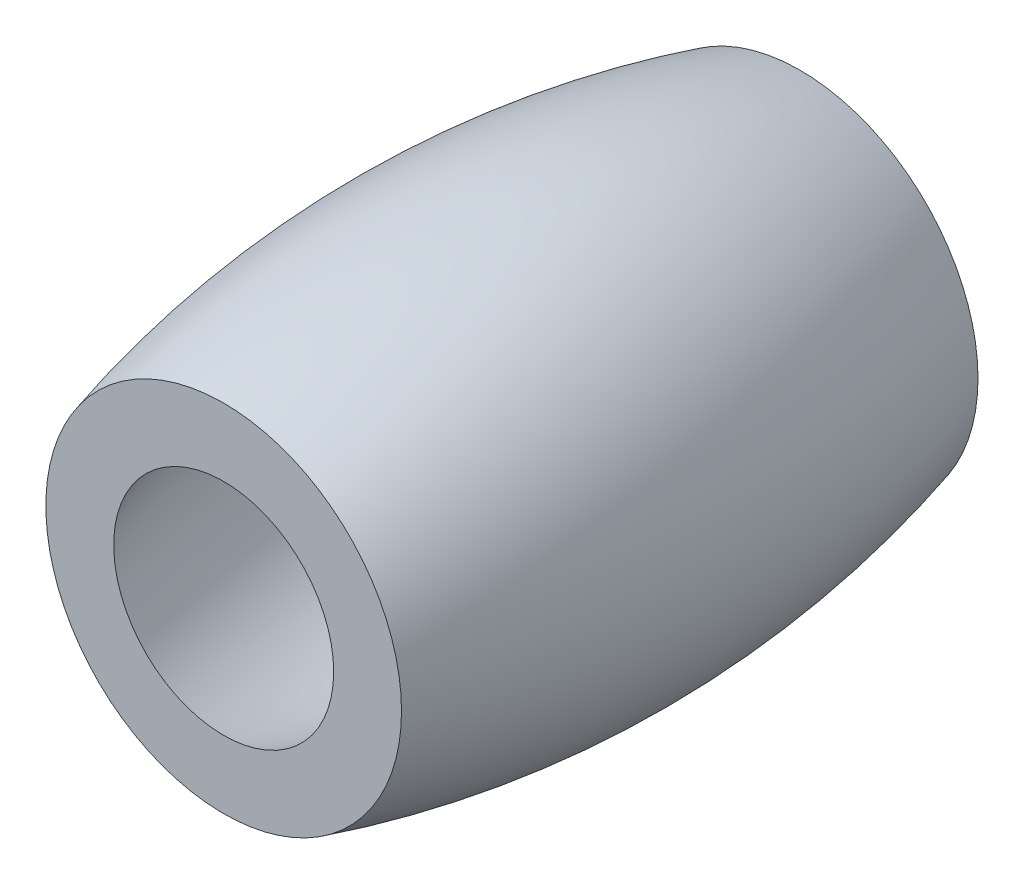
from build123d import *


with BuildPart() as part:
    # Sketch1 → Revolve1 (revolve)
    with BuildSketch(Plane(origin=(0, 0, 0), x_dir=(0, 0, -1), z_dir=(1, 0, 0)), mode=Mode.PRIVATE) as revolve1_sk:
        with BuildLine():
            Line((-8.5, 28.674075373), (-8.5, 30.674075373))
            ThreePointArc((-8.5, 30.674075373), (0, 31.83), (8.5, 30.674075373))
            Line((8.5, 30.674075373), (8.5, 28.674075373))
            ThreePointArc((8.5, 28.674075373), (0, 29.83), (-8.5, 28.674075373))
        make_face()
    revolve(revolve1_sk.sketch.rotate(Axis((0, 25.43, 0), (0, 0, -1)), 90), axis=Axis((0, 25.43, 0), (0, 0, -1)))


solid = part.part
